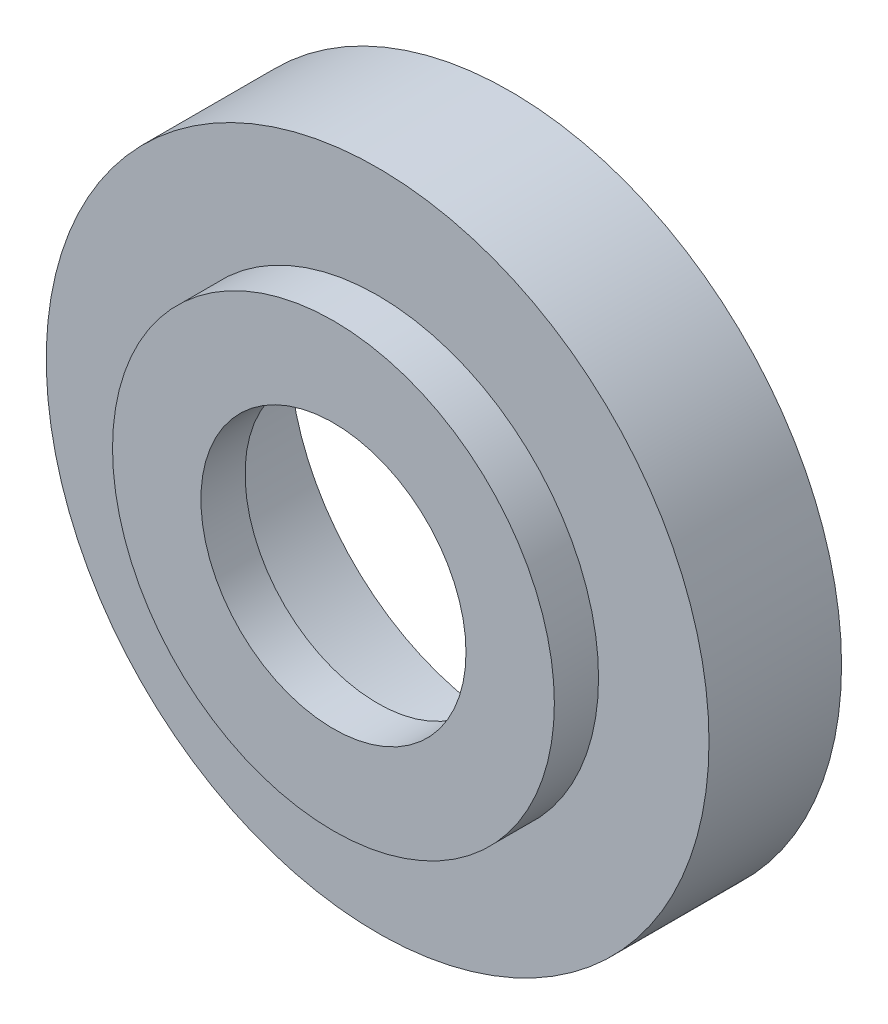
from build123d import *

# Parameters (mm, degrees)
SKETCH1_R           = 3.75
SKETCH1_R_2         = 2.5
BOSS_EXTRUDE1_DEPTH = 1.5
BOSS_EXTRUDE2_START = 1.5
SKETCH1_3_R         = 2.5
SKETCH1_3_R_2       = 1.5
BOSS_EXTRUDE2_DEPTH = 0.5


with BuildPart() as part:
    # Sketch1 → Boss-Extrude1 (new body)
    with BuildSketch(Plane.XY):
        Circle(SKETCH1_R)
        Circle(SKETCH1_R_2, mode=Mode.SUBTRACT)
    extrude(amount=BOSS_EXTRUDE1_DEPTH)


with BuildPart() as body_2:
    # Sketch1<3> → Boss-Extrude2 (new body)
    with BuildSketch(Plane.XY.offset(BOSS_EXTRUDE2_START)):
        Circle(SKETCH1_3_R)
        Circle(SKETCH1_3_R_2, mode=Mode.SUBTRACT)
    extrude(amount=BOSS_EXTRUDE2_DEPTH)


solid = Compound([part.part, body_2.part])
